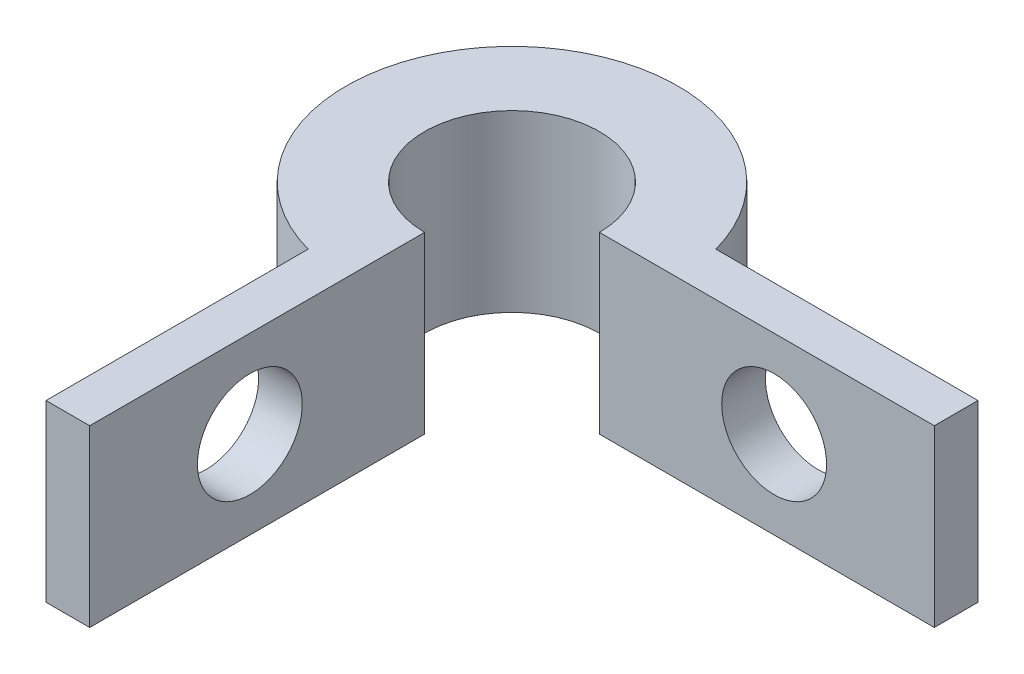
from build123d import *

# Parameters (mm, degrees)
BOSS_EXTRUDE1_DEPTH = 10
SKETCH2_R           = 3
CUT_EXTRUDE1_DEPTH  = 38.349495851
CIRPATTERN1_COUNT   = 2
CIRPATTERN1_ANGLE   = 90


with BuildPart() as part:
    # Sketch1 → Boss-Extrude1 (new body)
    with BuildSketch(Plane(origin=(0, 0, 0), x_dir=(1, 0, 0), z_dir=(0, 1, 0))):
        with BuildLine():
            Line((0, -24.16515139), (0, -5))
            ThreePointArc((0, -5), (-3.535533906, 3.535533906), (5, 0))
            Line((5, 0), (24.16515139, 0))
            Line((24.16515139, 0), (24.16515139, 2.5))
            Line((24.16515139, 2.5), (9.16515139, 2.5))
            ThreePointArc((9.16515139, 2.5), (-6.717514421, 6.717514421), (-2.5, -9.16515139))
            Line((-2.5, -9.16515139), (-2.5, -24.16515139))
            Line((-2.5, -24.16515139), (0, -24.16515139))
        make_face()
    extrude(amount=BOSS_EXTRUDE1_DEPTH)

    # Sketch2 → Cut-Extrude1 (cut, through all)
    with BuildSketch(Plane.ZY.offset(2.5)):
        with Locations((15, 5)):
            Circle(SKETCH2_R)
    cut_extrude1 = extrude(amount=-CUT_EXTRUDE1_DEPTH, mode=Mode.SUBTRACT)

    # CirPattern1: Cut-Extrude1 ×2 about axis
    cirpattern1_axis = Axis((0, 10, 0), (0, 1, 0))
    for i in range(1, CIRPATTERN1_COUNT):
        add(cut_extrude1.rotate(cirpattern1_axis, i * CIRPATTERN1_ANGLE / (CIRPATTERN1_COUNT - 1)), mode=Mode.SUBTRACT)


solid = part.part
